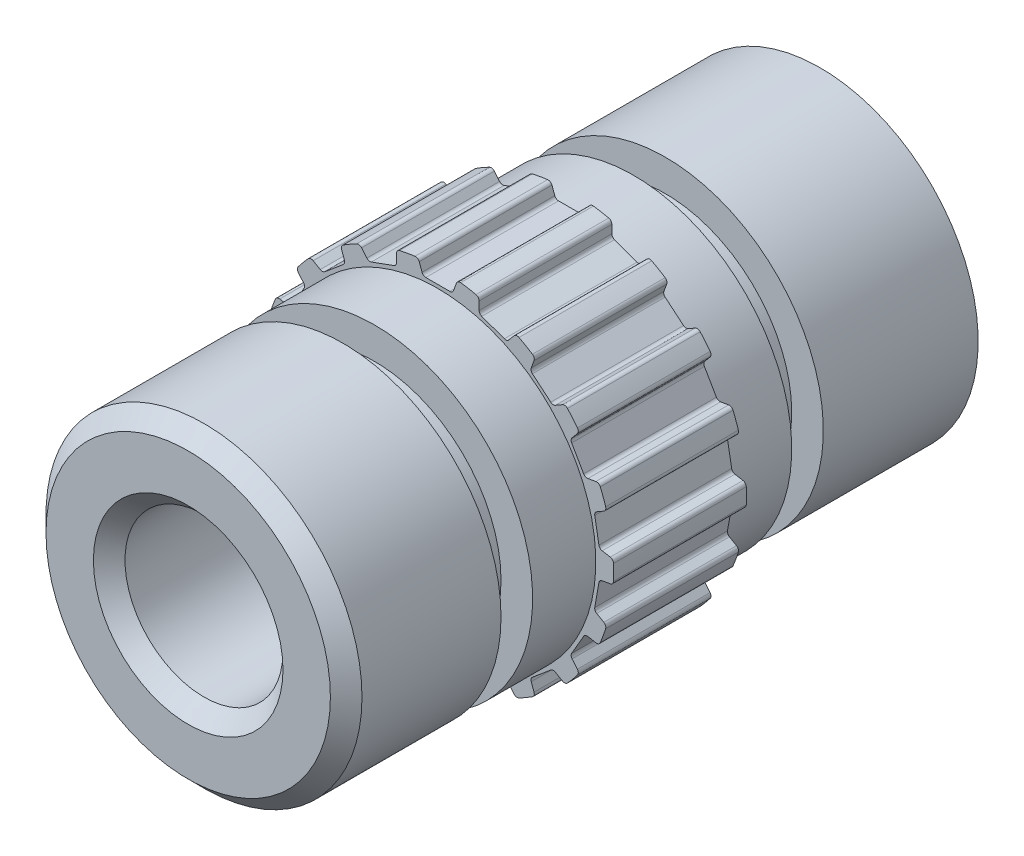
from build123d import *

# Parameters (mm, degrees)
GEARBELT_BASESKETCH_W  = 6
GEARBELT_BASESKETCH_H  = 5.567251199
TOOTH_EXTRUDE_START    = -2.1
TOOTH_EXTRUDE_DEPTH    = 4.2
TOOTH_PATTERN_18_COUNT = 18
SKETCH4_R              = 5
EXTRUDE_802_DEPTH      = 7
BOSS_EXTRUDE3_START    = 8
SKETCH8_R              = 5
BOSS_EXTRUDE3_DEPTH    = 8
SKETCH6_R              = 1.65
CUT_EXTRUDE_1046_DEPTH = 5
SKETCH5_R              = 2.5
CUT_EXTRUDE4_DEPTH     = 23
CHAMFER1_SIZE          = 0.5
CHAMFER3_SIZE          = 1
CHAMFER3_SIZE2         = 1.732050808


with BuildPart() as part:
    # GearBelt-BaseSketch → 0.080in Pitch 'MXL', 0.125in Belt Width, 11,6425mm P.D. (revolve)
    with BuildSketch(Plane(origin=(0, 0, 0), x_dir=(0, 0, -1), z_dir=(1, 0, 0)), mode=Mode.PRIVATE) as f_0_080in_pitch_mxl_0_125in_belt_width_sk:
        with Locations((0, 2.7836256)):
            Rectangle(GEARBELT_BASESKETCH_W, GEARBELT_BASESKETCH_H)
    revolve(f_0_080in_pitch_mxl_0_125in_belt_width_sk.sketch.rotate(Axis((0, 0, 3.048), (0, 0, -1)), 90), axis=Axis((0, 0, 3.048), (0, 0, -1)))

    # Tooth-Sketch → Tooth-Extrude (cut)
    with BuildSketch(Plane.XY.offset(TOOTH_EXTRUDE_START)):
        with BuildLine():
            Line((-0.379703626, 5.110051208), (0.379703626, 5.110051208))
            ThreePointArc((0.379703626, 5.110051208), (0.452547836, 5.133018899), (0.499044593, 5.193614652))
            Line((0.499044593, 5.193614652), (0.587822803, 5.43753078))
            ThreePointArc((0.587822803, 5.43753078), (0.641250062, 5.502650124), (0.723672162, 5.520016713))
            Line((0.723672162, 5.520016713), (0.723672162, 8.060016713))
            Line((0.723672162, 8.060016713), (-0.723672162, 8.060016713))
            Line((-0.723672162, 8.060016713), (-0.723672162, 5.520016713))
            ThreePointArc((-0.723672162, 5.520016713), (-0.641250062, 5.502650124), (-0.587822803, 5.43753078))
            Line((-0.587822803, 5.43753078), (-0.499044593, 5.193614652))
            ThreePointArc((-0.499044593, 5.193614652), (-0.452547836, 5.133018899), (-0.379703626, 5.110051208))
        make_face()
    tooth_extrude = extrude(amount=TOOTH_EXTRUDE_DEPTH, mode=Mode.SUBTRACT)

    # Tooth Pattern, 18: Tooth-Extrude ×18 about axis
    tooth_pattern_18_axis = Axis((0, 0, 0), (0, 0, 1))
    for i in range(1, TOOTH_PATTERN_18_COUNT):
        add(tooth_extrude.rotate(tooth_pattern_18_axis, i * 360 / TOOTH_PATTERN_18_COUNT), mode=Mode.SUBTRACT)

    # Sketch4 → Extrude 802 (add)
    with BuildSketch(Plane.XY.offset(3)):
        with Locations(Location((0, 0, 0), (0, 0, 180))):
            Circle(SKETCH4_R)
    extrude(amount=EXTRUDE_802_DEPTH)

    # Sketch8 → Boss-Extrude3 (add)
    with BuildSketch(Plane(origin=(0, 0, -3), x_dir=(-1, 0, 0), z_dir=(0, 0, -1)).offset(BOSS_EXTRUDE3_START)):
        Circle(SKETCH8_R)
    extrude(amount=-BOSS_EXTRUDE3_DEPTH)

    # Sketch6 → Cut-Extrude 1046 (cut)
    with BuildSketch(Plane.ZY.offset(5)):
        with Locations((-7.5, 0)):
            Circle(SKETCH6_R)
    extrude(amount=-CUT_EXTRUDE_1046_DEPTH, mode=Mode.SUBTRACT)

    # Sketch5 → Cut-Extrude4 (cut)
    with BuildSketch(Plane.XY.offset(10)):
        Circle(SKETCH5_R)
    extrude(amount=-CUT_EXTRUDE4_DEPTH, mode=Mode.SUBTRACT)

    # Chamfer1
    chamfer1_edges = [part.edges().sort_by_distance(p)[0] for p in [
        (5, 0, 10),
        (-2.5, 0, 10),
    ]]
    chamfer(chamfer1_edges, length=CHAMFER1_SIZE)

    # Chamfer3
    chamfer3_edges = [part.edges().sort_by_distance(p)[0] for p in [
        (5, 0, -11),
    ]]
    chamfer3_side = [part.faces().sort_by_distance(p)[0] for p in [
        (5, 0, -7),
    ]]
    chamfer(chamfer3_edges, length=CHAMFER3_SIZE, length2=CHAMFER3_SIZE2, reference=chamfer3_side[0])

    # Sketch10 → Cut-Revolve2 (revolve, cut)
    with BuildSketch(Plane.ZY, mode=Mode.PRIVATE) as cut_revolve2_sk:
        Polygon((4.1, -4), (4.1, -5), (2.1, -5), (2.1, -5.788988476), (4.1, -5.788988476), (5.1, -5.788988476), (5.1, -4), align=None)
        Polygon((-4.1, -4), (-5.1, -4), (-5.1, -5.788988476), (-4.1, -5.788988476), (-2.1, -5.788988476), (-2.1, -5), (-4.1, -5), align=None)
    revolve(cut_revolve2_sk.sketch.rotate(Axis((0, 0, -15.590292469), (0, 0, 1)), 270), axis=Axis((0, 0, -15.590292469), (0, 0, 1)), mode=Mode.SUBTRACT)


solid = part.part
